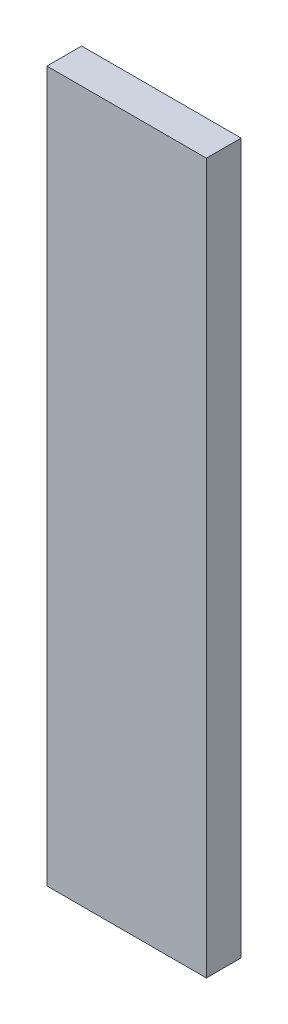
from build123d import *

# Parameters (mm, degrees)
SKETCH1_W           = 32.12
SKETCH1_H           = 143
BOSS_EXTRUDE1_DEPTH = 7


with BuildPart() as part:
    # Sketch1 → Boss-Extrude1 (new body)
    with BuildSketch(Plane.XY):
        with Locations((-5.658230088, -40.410265487)):
            Rectangle(SKETCH1_W, SKETCH1_H)
    extrude(amount=BOSS_EXTRUDE1_DEPTH)


solid = part.part
